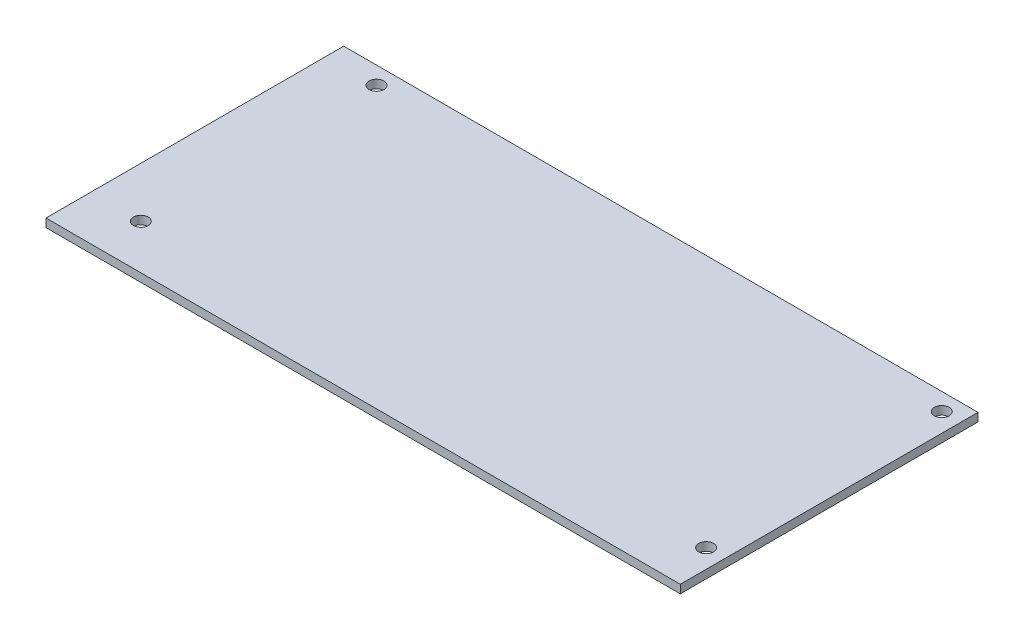
from build123d import *

# Parameters (mm, degrees)
SKETCH1_W           = 137
SKETCH1_H           = 64.3
BOSS_EXTRUDE1_DEPTH = 1.8
SKETCH2_R           = 1.6
CUT_EXTRUDE1_DEPTH  = 2


with BuildPart() as part:
    # Sketch1 → Boss-Extrude1 (new body)
    with BuildSketch(Plane(origin=(0, 0, 0), x_dir=(1, 0, 0), z_dir=(0, 1, 0))):
        Rectangle(SKETCH1_W, SKETCH1_H)
    extrude(amount=BOSS_EXTRUDE1_DEPTH)

    # Sketch2 → Cut-Extrude1 (cut)
    with BuildSketch(Plane(origin=(0, 1.8, 0), x_dir=(1, 0, 0), z_dir=(0, 1, 0))):
        with Locations(Location((-57.65, 28.38, 0), (0, 0, 270))):
            Circle(SKETCH2_R)
        with Locations(Location((-57.65, -22.52, 0), (0, 0, 270))):
            Circle(SKETCH2_R)
        with Locations(Location((64.45, 28.38, 0), (0, 0, 270))):
            Circle(SKETCH2_R)
        with Locations(Location((64.45, -22.52, 0), (0, 0, 270))):
            Circle(SKETCH2_R)
    extrude(amount=-CUT_EXTRUDE1_DEPTH, mode=Mode.SUBTRACT)


solid = part.part
